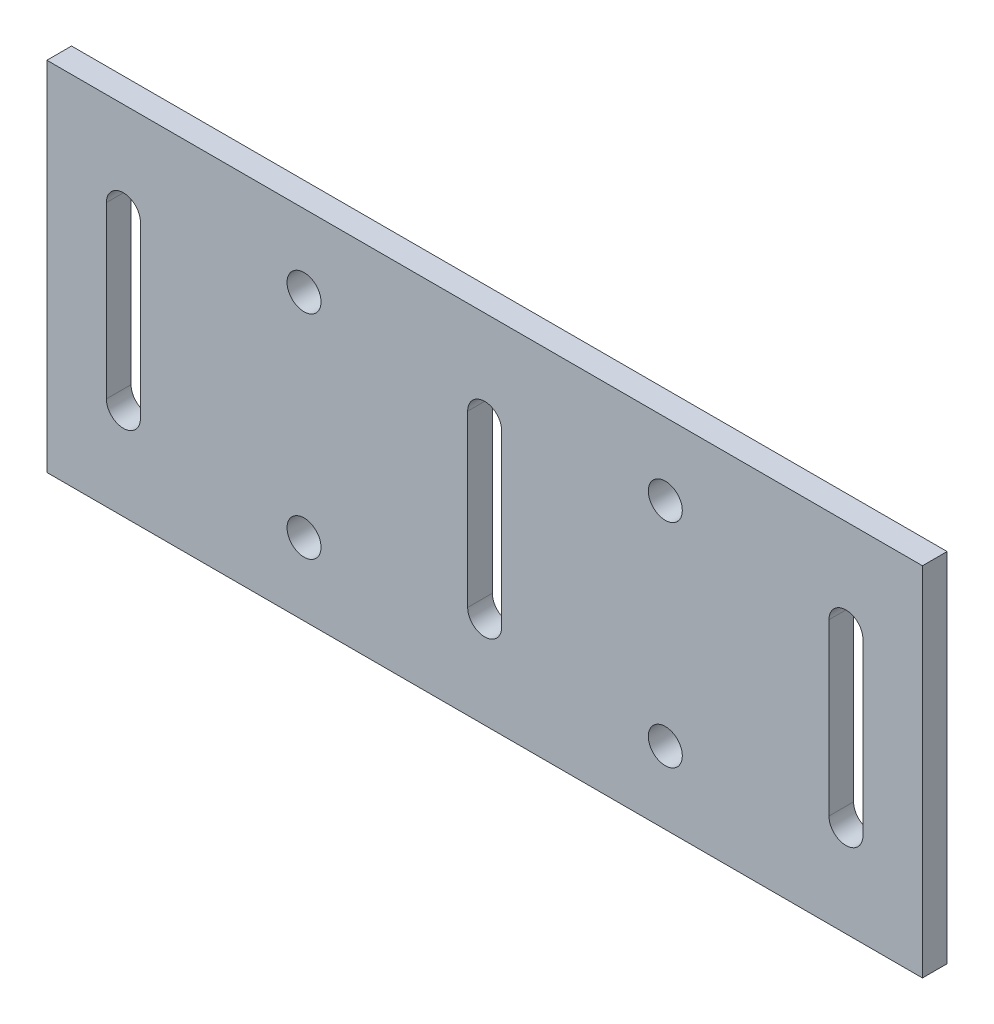
from build123d import *

# Parameters (mm, degrees)
SKETCH_1_W          = 206
SKETCH_1_H          = 84
EXTRUDE_1_DEPTH     = 5.8
CUT_EXTRUDE_1_REACH = 224.544
SKETCH_2_R          = 4


with BuildPart() as part:
    # Эскиз1 → Бобышка-Вытянуть1 (new body)
    with BuildSketch(Plane.XY):
        with Locations((103, 42)):
            Rectangle(SKETCH_1_W, SKETCH_1_H)
        with BuildLine():
            Line((22, 62), (22, 22))
            ThreePointArc((22, 22), (18, 18), (14, 22))
            Line((14, 22), (14, 62))
            ThreePointArc((14, 62), (18, 66), (22, 62))
        make_face(mode=Mode.SUBTRACT)
        with BuildLine():
            Line((107, 62), (107, 22))
            ThreePointArc((107, 22), (103, 18), (99, 22))
            Line((99, 22), (99, 62))
            ThreePointArc((99, 62), (103, 66), (107, 62))
        make_face(mode=Mode.SUBTRACT)
        with BuildLine():
            Line((192, 62), (192, 22))
            ThreePointArc((192, 22), (188, 18), (184, 22))
            Line((184, 22), (184, 62))
            ThreePointArc((184, 62), (188, 66), (192, 62))
        make_face(mode=Mode.SUBTRACT)
    extrude(amount=EXTRUDE_1_DEPTH)

    # Эскиз2 → Вырез-Вытянуть1 (cut, up to next)
    with BuildSketch(Plane.XY.offset(5.8), mode=Mode.PRIVATE) as cut_extrude_1_sk1:
        with Locations((60.5, 67)):
            Circle(SKETCH_2_R)
    cut_extrude_1_tool1 = extrude(cut_extrude_1_sk1.sketch, amount=-CUT_EXTRUDE_1_REACH, mode=Mode.PRIVATE) & part.part
    # Эскиз2 → Вырез-Вытянуть1 (cut, up to next)
    with BuildSketch(Plane.XY.offset(5.8), mode=Mode.PRIVATE) as cut_extrude_1_sk2:
        with Locations((60.5, 17)):
            Circle(SKETCH_2_R)
    cut_extrude_1_tool2 = extrude(cut_extrude_1_sk2.sketch, amount=-CUT_EXTRUDE_1_REACH, mode=Mode.PRIVATE) & part.part
    # Эскиз2 → Вырез-Вытянуть1 (cut, up to next)
    with BuildSketch(Plane.XY.offset(5.8), mode=Mode.PRIVATE) as cut_extrude_1_sk3:
        with Locations((145.5, 17)):
            Circle(SKETCH_2_R)
    cut_extrude_1_tool3 = extrude(cut_extrude_1_sk3.sketch, amount=-CUT_EXTRUDE_1_REACH, mode=Mode.PRIVATE) & part.part
    # Эскиз2 → Вырез-Вытянуть1 (cut, up to next)
    with BuildSketch(Plane.XY.offset(5.8), mode=Mode.PRIVATE) as cut_extrude_1_sk4:
        with Locations((145.5, 67)):
            Circle(SKETCH_2_R)
    cut_extrude_1_tool4 = extrude(cut_extrude_1_sk4.sketch, amount=-CUT_EXTRUDE_1_REACH, mode=Mode.PRIVATE) & part.part
    add(cut_extrude_1_tool1.solids().sort_by_distance((60.5, 67, 5.8))[0], mode=Mode.SUBTRACT)
    add(cut_extrude_1_tool2.solids().sort_by_distance((60.5, 17, 5.8))[0], mode=Mode.SUBTRACT)
    add(cut_extrude_1_tool3.solids().sort_by_distance((145.5, 17, 5.8))[0], mode=Mode.SUBTRACT)
    add(cut_extrude_1_tool4.solids().sort_by_distance((145.5, 67, 5.8))[0], mode=Mode.SUBTRACT)


solid = part.part
